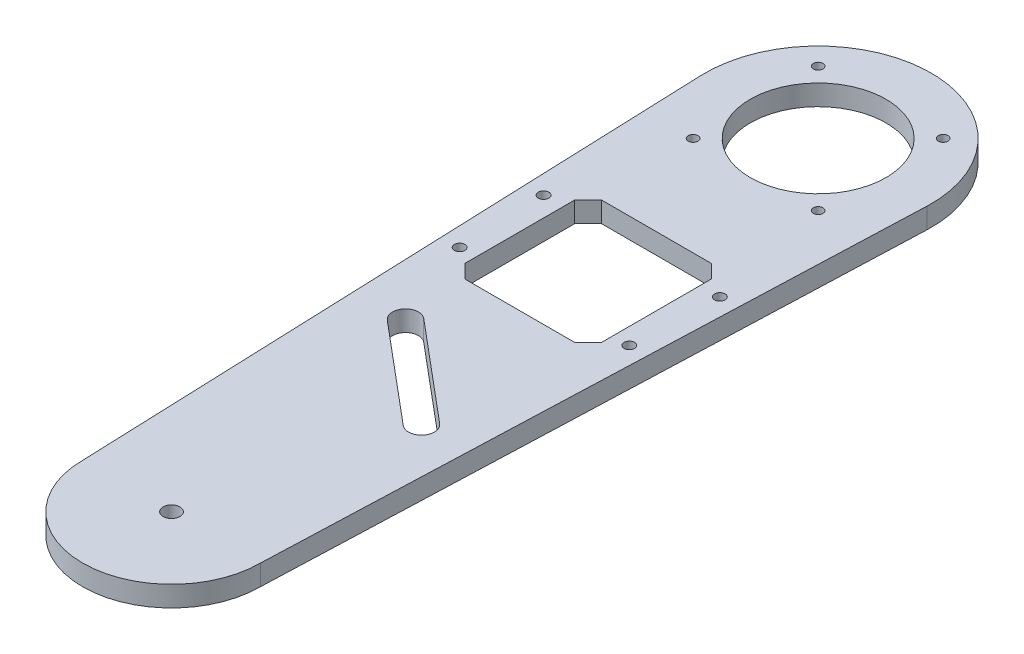
from build123d import *

# Parameters (mm, degrees)
BOSS_EXTRUDE1_DEPTH     = 6.35
SKETCH2_R               = 2.6
CUT_EXTRUDE1_DEPTH      = 238.676928834
ESQUISSE3_R             = 21
ENL_V_MAT_EXTRU_2_DEPTH = 238.676928834
ESQUISSE7_R             = 1.5
ENL_V_MAT_EXTRU_3_DEPTH = 238.676928834
CUT_EXTRUDE2_DEPTH      = 238.676928834
SKETCH5_R               = 1.625
CUT_EXTRUDE3_DEPTH      = 238.676928834
CUT_EXTRUDE5_DEPTH      = 238.676928834


with BuildPart() as part:
    # Sketch1 → Boss-Extrude1 (new body)
    with BuildSketch(Plane(origin=(0, 0, 0), x_dir=(1, 0, 0), z_dir=(0, 1, 0))):
        with BuildLine():
            Line((27.5, 0), (34.975254116, 198.684097441))
            ThreePointArc((34.975254116, 198.684097441), (0, 235), (-34.975254116, 198.684097441))
            Line((-34.975254116, 198.684097441), (-27.5, 0))
            ThreePointArc((-27.5, 0), (0, -27.5), (27.5, 0))
        make_face()
    extrude(amount=BOSS_EXTRUDE1_DEPTH)

    # Sketch2 → Cut-Extrude1 (cut, through all)
    with BuildSketch(Plane(origin=(0, 6.35, 0), x_dir=(1, 0, 0), z_dir=(0, 1, 0))):
        with Locations(Location((0, 0, 0), (0, 0, 270))):
            Circle(SKETCH2_R)
    extrude(amount=-CUT_EXTRUDE1_DEPTH, mode=Mode.SUBTRACT)

    # Esquisse3 → Enlèv. mat.-Extru.2 (cut, through all)
    with BuildSketch(Plane(origin=(0, 6.35, 0), x_dir=(1, 0, 0), z_dir=(0, 1, 0))):
        with Locations(Location((0, 200, 0), (0, 0, 270))):
            Circle(ESQUISSE3_R)
    extrude(amount=-ENL_V_MAT_EXTRU_2_DEPTH, mode=Mode.SUBTRACT)

    # Esquisse7 → Enlèv. mat.-Extru.3 (cut, through all)
    with BuildSketch(Plane(origin=(0, 6.35, 0), x_dir=(1, 0, 0), z_dir=(0, 1, 0))):
        with Locations(Location((-19.339370465, 219.339370465, 0), (0, 0, 270))):
            Circle(ESQUISSE7_R)
        with Locations(Location((19.339370465, 219.339370465, 0), (0, 0, 270))):
            Circle(ESQUISSE7_R)
        with Locations(Location((19.339370465, 180.660629535, 0), (0, 0, 270))):
            Circle(ESQUISSE7_R)
        with Locations(Location((-19.339370465, 180.660629535, 0), (0, 0, 270))):
            Circle(ESQUISSE7_R)
    extrude(amount=-ENL_V_MAT_EXTRU_3_DEPTH, mode=Mode.SUBTRACT)

    # Sketch3 → Cut-Extrude2 (cut, through all)
    with BuildSketch(Plane(origin=(0, 6.35, 0), x_dir=(1, 0, 0), z_dir=(0, 1, 0))):
        Polygon((21.15, 145.828069991), (21.15, 111.871930009), (16.978069991, 107.7), (-16.978069991, 107.7), (-21.15, 111.871930009), (-21.15, 145.828069991), (-16.978069991, 150), (16.978069991, 150), align=None)
    extrude(amount=-CUT_EXTRUDE2_DEPTH, mode=Mode.SUBTRACT)

    # Sketch5 → Cut-Extrude3 (cut, through all)
    with BuildSketch(Plane(origin=(0, 6.35, 0), x_dir=(1, 0, 0), z_dir=(0, 1, 0))):
        with Locations(Location((-27.256476824, 142.340455159, 0), (0, 0, 270))):
            Circle(SKETCH5_R)
        with Locations(Location((-26.241351992, 115.359544841, 0), (0, 0, 270))):
            Circle(SKETCH5_R)
    cut_extrude3 = extrude(amount=-CUT_EXTRUDE3_DEPTH, mode=Mode.SUBTRACT)

    # Mirror1: Cut-Extrude3 across plane
    add(cut_extrude3.mirror(Plane(origin=(0, 0, 0), x_dir=(0, 0, 1), z_dir=(1, 0, 0))), mode=Mode.SUBTRACT)

    # Sketch8 → Cut-Extrude5 (cut, through all)
    with BuildSketch(Plane(origin=(0, 6.35, 0), x_dir=(1, 0, 0), z_dir=(0, 1, 0))):
        with BuildLine():
            Line((-12.749738424, 90.764177772), (17.892039301, 65.052673385))
            ThreePointArc((17.892039301, 65.052673385), (18.385066635, 59.417345174), (12.749738424, 58.92431784))
            Line((12.749738424, 58.92431784), (-17.892039301, 84.635822228))
            ThreePointArc((-17.892039301, 84.635822228), (-18.385066635, 90.271150439), (-12.749738424, 90.764177772))
        make_face()
    extrude(amount=-CUT_EXTRUDE5_DEPTH, mode=Mode.SUBTRACT)


solid = part.part
